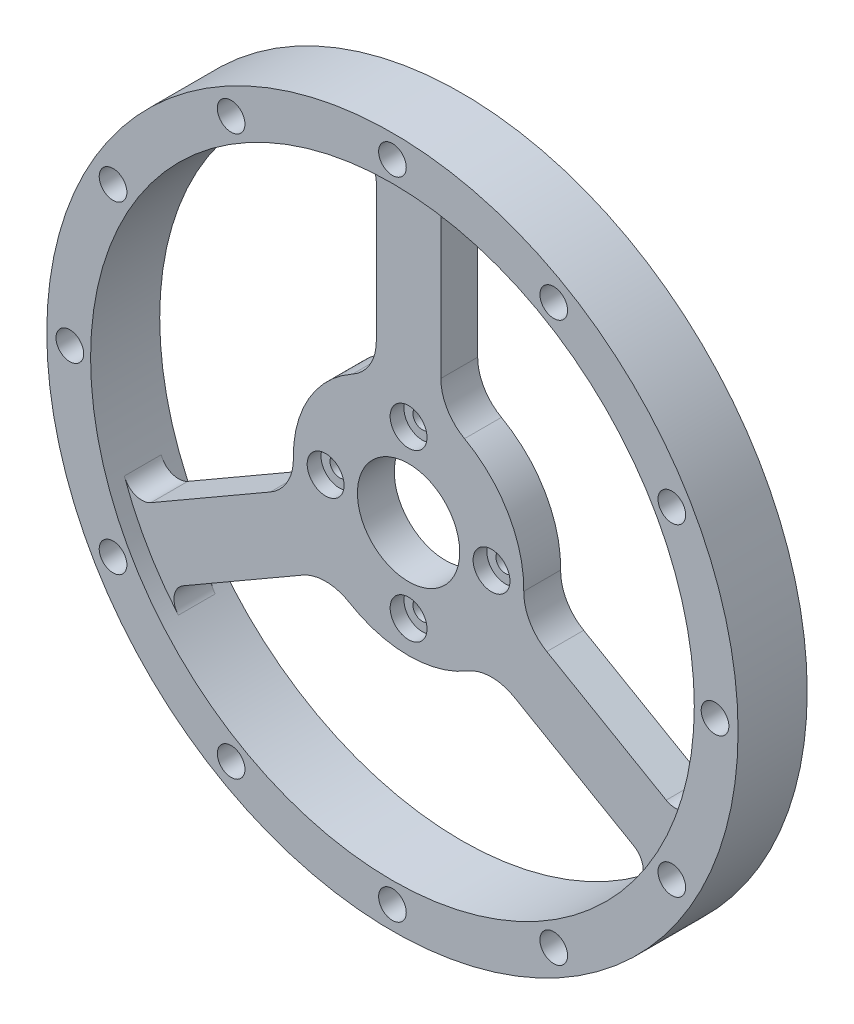
from build123d import *

# Parameters (mm, degrees)
SKETCH1_R               = 75
BOSS_EXTRUDE1_DEPTH     = 15
CUT_EXTRUDE1_DEPTH      = 108.121426428
CUT_EXTRUDE1_DEPTH_BACK = 108.121426428
SKETCH2_R               = 65.5
BOSS_EXTRUDE3_START     = 3.5
SKETCH5_R               = 25
BOSS_EXTRUDE3_DEPTH     = 8
BOSS_EXTRUDE4_START     = 3.5
SKETCH6_W               = 14
SKETCH6_H               = 45
BOSS_EXTRUDE4_DEPTH     = 8
SKETCH9_R               = 11.1
CUT_EXTRUDE4_DEPTH      = 108.121426428
SKETCH10_R              = 2.05
CUT_EXTRUDE5_DEPTH      = 108.121426428
FILLET3_R               = 10
CUT_EXTRUDE6_START      = 8.5
SKETCH11_R              = 4
CUT_EXTRUDE6_DEPTH      = 3
SKETCH12_R              = 3
CUT_EXTRUDE7_DEPTH      = 108.121426428
FILLET4_R               = 4


with BuildPart() as part:
    # Sketch1 → Boss-Extrude1 (new body)
    with BuildSketch(Plane.XY):
        Circle(SKETCH1_R)
    extrude(amount=BOSS_EXTRUDE1_DEPTH)

    # Sketch2 → Cut-Extrude1 (cut, two sides: drawn at the far end of the back side and taken through both)
    with BuildSketch(Plane.XY.offset(-CUT_EXTRUDE1_DEPTH_BACK)):
        Circle(SKETCH2_R)
    extrude(amount=CUT_EXTRUDE1_DEPTH + CUT_EXTRUDE1_DEPTH_BACK, mode=Mode.SUBTRACT)



with BuildPart() as body_2:
    # Sketch5 → Boss-Extrude3 (new body)
    with BuildSketch(Plane.XY.offset(BOSS_EXTRUDE3_START)):
        Circle(SKETCH5_R)
    extrude(amount=BOSS_EXTRUDE3_DEPTH)


with BuildPart() as part_1:
    add(part.part)

    add(body_2.part)  # Boss-Extrude4 merges body 2
    # Sketch6 → Boss-Extrude4 (add)
    with BuildSketch(Plane.XY.offset(BOSS_EXTRUDE4_START)):
        with Locations((0, 46.5)):
            Rectangle(SKETCH6_W, SKETCH6_H)
        Polygon((17.284609691, -18.062177826), (56.255752861, -40.562177826), (63.255752861, -28.437822174), (24.284609691, -5.937822174), align=None)
        Polygon((-17.284609691, -18.062177826), (-56.255752861, -40.562177826), (-63.255752861, -28.437822174), (-24.284609691, -5.937822174), align=None)
    extrude(amount=BOSS_EXTRUDE4_DEPTH)

    # Sketch9 → Cut-Extrude4 (cut, through all)
    with BuildSketch(Plane.XY):
        Circle(SKETCH9_R)
    extrude(amount=CUT_EXTRUDE4_DEPTH, mode=Mode.SUBTRACT)

    # Sketch10 → Cut-Extrude5 (cut, through all)
    with BuildSketch(Plane.XY):
        with Locations((0, 18)):
            Circle(SKETCH10_R)
        with Locations((18, 0)):
            Circle(SKETCH10_R)
        with Locations((0, -18)):
            Circle(SKETCH10_R)
        with Locations((-18, 0)):
            Circle(SKETCH10_R)
    extrude(amount=CUT_EXTRUDE5_DEPTH, mode=Mode.SUBTRACT)

    # Fillet3
    fillet3_edges = [part_1.edges().sort_by_distance(p)[0] for p in [
        (-7, 24, 7.5),
        (7, 24, 7.5),
        (24.284609691, -5.937822174, 7.5),
        (17.284609691, -18.062177826, 7.5),
        (-17.284609691, -18.062177826, 7.5),
        (-24.284609691, -5.937822174, 7.5),
    ]]
    fillet(fillet3_edges, radius=FILLET3_R)

    # Sketch11 → Cut-Extrude6 (cut)
    with BuildSketch(Plane.XY.offset(CUT_EXTRUDE6_START)):
        with Locations((18, 0)):
            Circle(SKETCH11_R)
        with Locations((0, -18)):
            Circle(SKETCH11_R)
        with Locations((-18, 0)):
            Circle(SKETCH11_R)
        with Locations((0, 18)):
            Circle(SKETCH11_R)
    extrude(amount=CUT_EXTRUDE6_DEPTH, mode=Mode.SUBTRACT)

    # Sketch12 → Cut-Extrude7 (cut, through all)
    with BuildSketch(Plane.XY.offset(15)):
        with Locations((0, 70)):
            Circle(SKETCH12_R)
        with Locations((35, 60.621778265)):
            Circle(SKETCH12_R)
        with Locations((60.621778265, 35)):
            Circle(SKETCH12_R)
        with Locations((70, 0)):
            Circle(SKETCH12_R)
        with Locations((60.621778265, -35)):
            Circle(SKETCH12_R)
        with Locations((35, -60.621778265)):
            Circle(SKETCH12_R)
        with Locations((0, -70)):
            Circle(SKETCH12_R)
        with Locations((-35, -60.621778265)):
            Circle(SKETCH12_R)
        with Locations((-60.621778265, -35)):
            Circle(SKETCH12_R)
        with Locations((-70, 0)):
            Circle(SKETCH12_R)
        with Locations((-60.621778265, 35)):
            Circle(SKETCH12_R)
        with Locations((-35, 60.621778265)):
            Circle(SKETCH12_R)
    extrude(amount=-CUT_EXTRUDE7_DEPTH, mode=Mode.SUBTRACT)

    # Fillet4
    fillet4_edges = [part_1.edges().sort_by_distance(p)[0] for p in [
        (7, 65.124880038, 7.5),
        (-7, 65.124880038, 7.5),
        (52.899800532, -38.624617846, 7.5),
        (59.899800532, -26.500262193, 7.5),
        (-59.899800532, -26.500262193, 7.5),
        (-52.899800532, -38.624617846, 7.5),
    ]]
    fillet(fillet4_edges, radius=FILLET4_R)


solid = part_1.part
